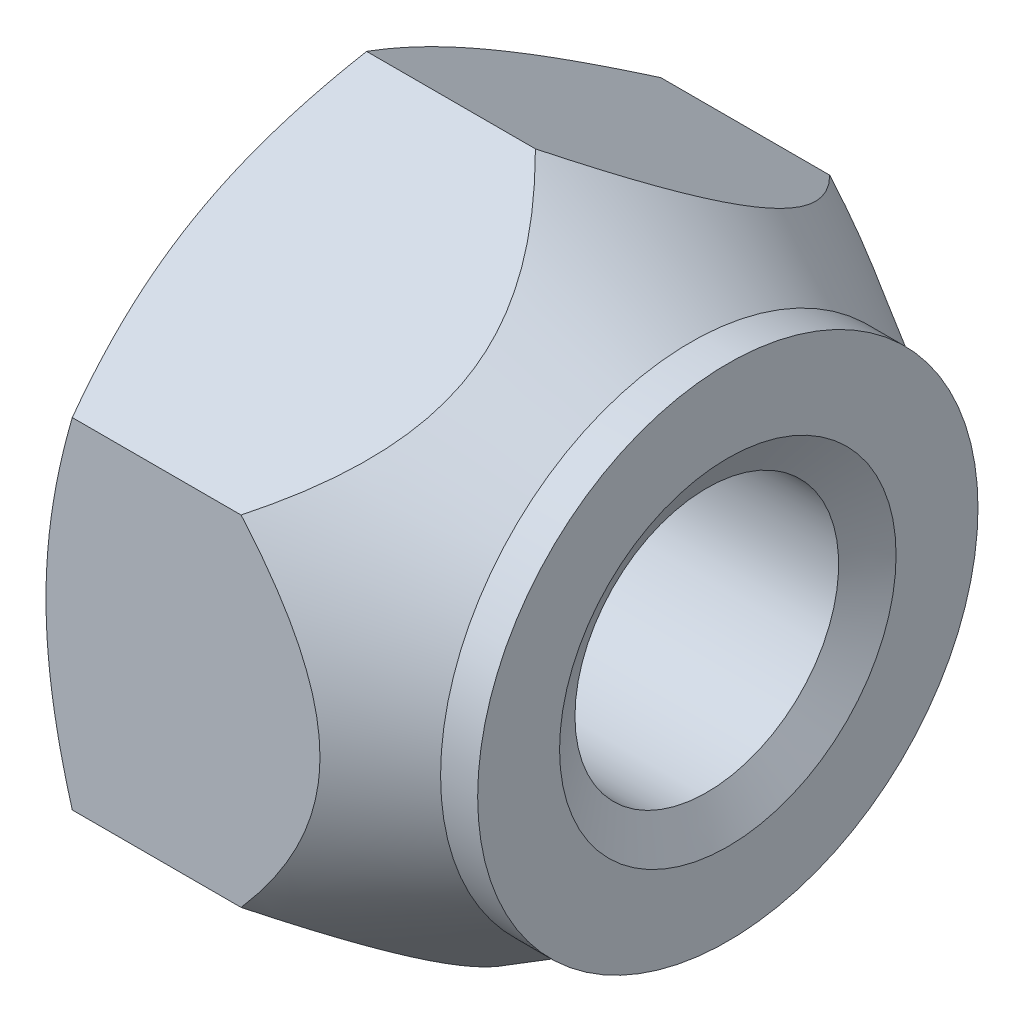
from build123d import *

# Parameters (mm, degrees)
BODY_DEPTH     = 7.3152
THREAD_D       = 4.9784
CHAMFER1_SIZE  = 0.687407664
CHAMFER1_SIZE2 = 0.396875
CHAMFER2_SIZE  = 0.687407664
CHAMFER2_SIZE2 = 0.396875


with BuildPart() as part:
    # Sketch1 → Body (new body)
    with BuildSketch(Plane.YZ):
        Polygon((-6.415804866, 0), (-3.207902433, 5.55625), (3.207902433, 5.55625), (6.415804866, 0), (3.207902433, -5.55625), (-3.207902433, -5.55625), align=None)
    extrude(amount=BODY_DEPTH)

    # Thread (through all)
    with Locations(Plane.ZY):
        with Locations((0, 0)):
            Hole(THREAD_D / 2)

    # Chamfer1
    chamfer1_edges = [part.edges().sort_by_distance(p)[0] for p in [
        (0, 0, 2.4892),
    ]]
    chamfer1_side = [part.faces().sort_by_distance(p)[0] for p in [
        (0, -4.664849093, 2.693251879),
    ]]
    chamfer(chamfer1_edges, length=CHAMFER1_SIZE, length2=CHAMFER1_SIZE2, reference=chamfer1_side[0])

    # Chamfer2
    chamfer2_edges = [part.edges().sort_by_distance(p)[0] for p in [
        (7.3152, 0, 2.4892),
    ]]
    chamfer2_side = [part.faces().sort_by_distance(p)[0] for p in [
        (7.3152, -4.664849093, 2.693251879),
    ]]
    chamfer(chamfer2_edges, length=CHAMFER2_SIZE, length2=CHAMFER2_SIZE2, reference=chamfer2_side[0])

    # Sketch4 → Chamfer3 (revolve, cut)
    with BuildSketch(Plane.XY, mode=Mode.PRIVATE) as chamfer3_sk:
        Polygon((0, 5.55625), (0.496264233, 6.415804866), (0, 6.415804866), align=None)
        Polygon((7.3152, 4.7228125), (7.3152, 6.415804866), (3.683, 6.415804866), (6.615348795, 4.7228125), align=None)
    revolve(chamfer3_sk.sketch.rotate(Axis((-1.46304, 0, 0), (1, 0, 0)), 90), axis=Axis((-1.46304, 0, 0), (1, 0, 0)), mode=Mode.SUBTRACT)


solid = part.part
